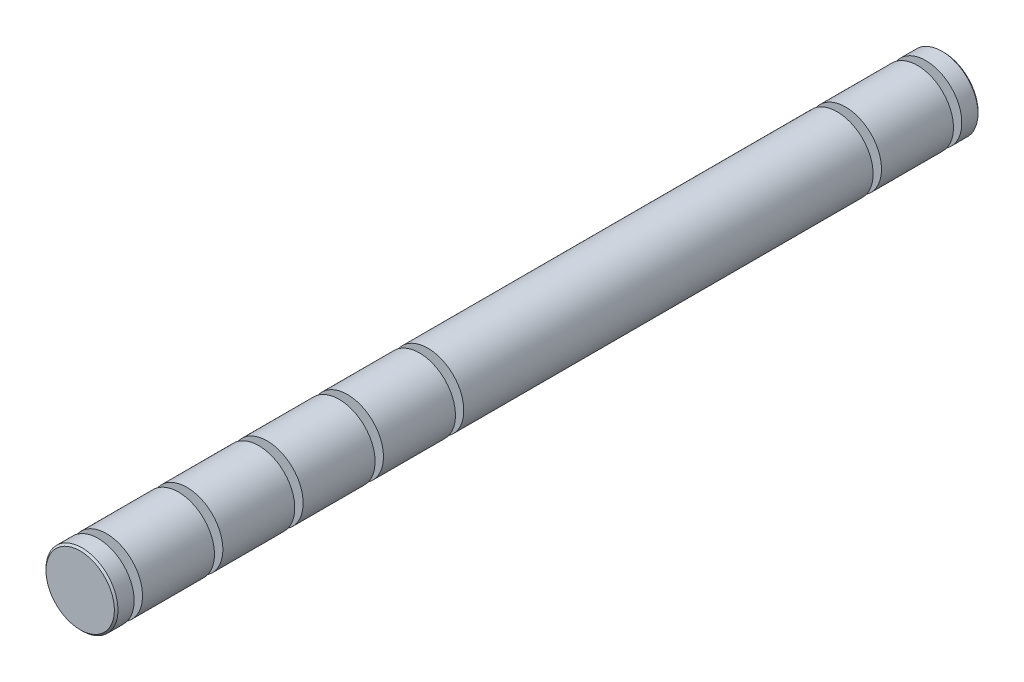
from build123d import *

# Parameters (mm, degrees)
SKETCH1_R      = 3.175
EXTRUDE1_DEPTH = 38.1
CHAMFER1_SIZE  = 0.15875


with BuildPart() as part:
    # Sketch1 → Extrude1 (new, symmetric)
    with BuildSketch(Plane.XY):
        with Locations(Location((0, 0, 0), (0, 0, 180))):
            Circle(SKETCH1_R)
    extrude(amount=EXTRUDE1_DEPTH, both=True)

    # Sketch6 → Cut-Revolve2 (revolve, cut)
    with BuildSketch(Plane(origin=(0, 0, 0), x_dir=(0, 0, -1), z_dir=(1, 0, 0)), mode=Mode.PRIVATE) as cut_revolve2_sk:
        Polygon((-36.5125, 3.175), (-36.5125, 1.5875), (-35.7759, 1.5875), (-35.7759, 3.175), (-29.4259, 3.175), (-29.4259, 1.5875), (-28.6893, 1.5875), (-28.6893, 3.175), (-22.3393, 3.175), (-22.3393, 1.5875), (-21.6027, 1.5875), (-21.6027, 3.175), (-15.2527, 3.175), (-15.2527, 1.5875), (-14.5161, 1.5875), (-14.5161, 3.175), (-8.1661, 3.175), (-8.1661, 1.5875), (-7.4295, 1.5875), (-7.4295, 3.175), (28.6893, 3.175), (28.6893, 1.5875), (29.4259, 1.5875), (29.4259, 3.175), (35.7759, 3.175), (35.7759, 1.5875), (36.5125, 1.5875), (36.5125, 3.175), (38.1, 3.175), (38.1, 5.715), (-38.1, 5.715), (-38.1, 3.175), align=None)
    revolve(cut_revolve2_sk.sketch.rotate(Axis((0, 0, 38.1), (0, 0, -1)), 270), axis=Axis((0, 0, 38.1), (0, 0, -1)), mode=Mode.SUBTRACT)

    # Chamfer1
    chamfer1_edges = [part.edges().sort_by_distance(p)[0] for p in [
        (3.175, 0, -38.1),
        (3.175, 0, 38.1),
    ]]
    chamfer(chamfer1_edges, length=CHAMFER1_SIZE)


solid = part.part
